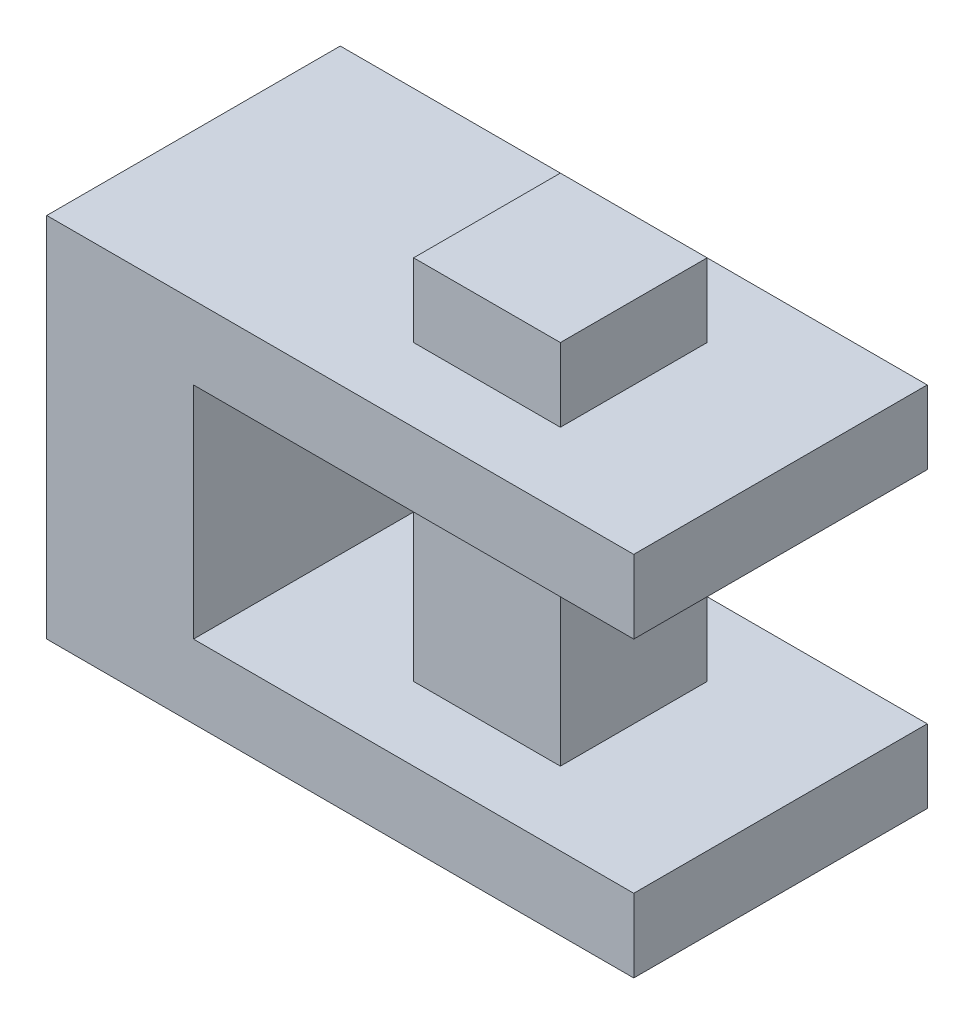
from build123d import *

# Parameters (mm, degrees)
BOSS_EXTRUDE1_DEPTH             = 20
SKETCH2_W                       = 10
SKETCH2_H                       = 10
BOSS_EXTRUDE2_DEPTH             = 5
BOSS_EXTRUDE2_DIRECTION_2_REACH = 53.235


with BuildPart() as part:
    # Sketch1 → Boss-Extrude1 (new body)
    with BuildSketch(Plane.XY):
        Polygon((0, 0), (40, 0), (40, 5), (10, 5), (10, 20), (40, 20), (40, 25), (0, 25), align=None)
    extrude(amount=BOSS_EXTRUDE1_DEPTH)

    # Sketch2 → Boss-Extrude2 (add)
    with BuildSketch(Plane(origin=(0, 25, 0), x_dir=(1, 0, 0), z_dir=(0, 1, 0))):
        with Locations((25, -10)):
            Rectangle(SKETCH2_W, SKETCH2_H)
    extrude(amount=BOSS_EXTRUDE2_DEPTH)

    # Sketch2 → Boss-Extrude2 direction 2 (add, up to next)
    with BuildSketch(Plane(origin=(0, 25, 0), x_dir=(1, 0, 0), z_dir=(0, 1, 0)), mode=Mode.PRIVATE) as boss_extrude2_direction_2_sk1:
        with Locations((25, -10)):
            Rectangle(SKETCH2_W, SKETCH2_H)
    boss_extrude2_direction_2_tool1 = extrude(boss_extrude2_direction_2_sk1.sketch, amount=-BOSS_EXTRUDE2_DIRECTION_2_REACH, mode=Mode.PRIVATE) - part.part
    add(boss_extrude2_direction_2_tool1.solids().sort_by_distance((25, 25, 10))[0])


solid = part.part
